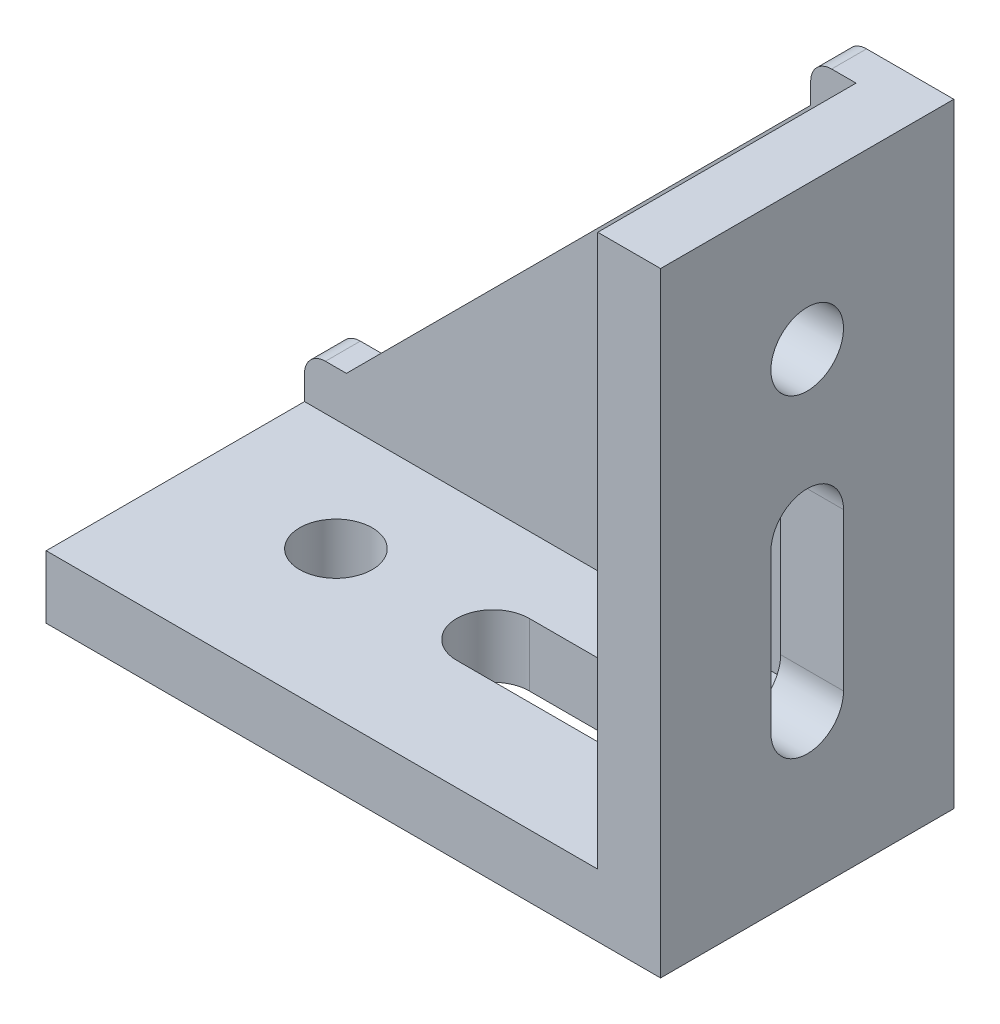
from build123d import *

# Parameters (mm, degrees)
EXTRUDE_1_DEPTH     = 21
EXTRUDE_2_DEPTH     = 5
SKETCH_5_R          = 5.2
CUT_EXTRUDE_1_DEPTH = 121.108284477


with BuildPart() as part:
    # 草图1 → 凸台-拉伸1 (new, symmetric)
    with BuildSketch(Plane.XY):
        Polygon((-88, 0), (0, 0), (0, 88), (-9, 88), (-9, 9), (-88, 9), align=None)
    extrude(amount=EXTRUDE_1_DEPTH, both=True)

    # 草图4 → 凸台-拉伸2 (add)
    with BuildSketch(Plane(origin=(0, 0, -21), x_dir=(-1, 0, 0), z_dir=(0, 0, -1))):
        with BuildLine():
            Line((88, 9), (88, 12.5))
            ThreePointArc((88, 12.5), (87.121320344, 14.621320344), (85, 15.5))
            Line((85, 15.5), (82, 15.5))
            Line((82, 15.5), (15.5, 82))
            Line((15.5, 82), (15.5, 85))
            ThreePointArc((15.5, 85), (14.621320344, 87.121320344), (12.5, 88))
            Line((12.5, 88), (9, 88))
            Line((9, 88), (9, 9))
            Line((9, 9), (88, 9))
        make_face()
    extrude(amount=-EXTRUDE_2_DEPTH)

    # 草图5 → 切除-拉伸1 (cut, through all)
    with BuildSketch(Plane(origin=(0, 9, 0), x_dir=(1, 0, 0), z_dir=(0, 1, 0))):
        with Locations(Location((-67.5, 0, 0), (0, 0, 270))):
            Circle(SKETCH_5_R)
        with BuildLine():
            Line((-45, 5.2), (-22.5, 5.2))
            ThreePointArc((-22.5, 5.2), (-17.3, 0), (-22.5, -5.2))
            Line((-22.5, -5.2), (-45, -5.2))
            ThreePointArc((-45, -5.2), (-50.2, 0), (-45, 5.2))
        make_face()
    cut_extrude_1 = extrude(amount=-CUT_EXTRUDE_1_DEPTH, mode=Mode.SUBTRACT)

    # 镜向1: 切除-拉伸1 across plane
    add(cut_extrude_1.mirror(Plane(origin=(0, 0, 0), x_dir=(0, 0, 1), z_dir=(-0.7071067811865477, -0.7071067811865475, 0))), mode=Mode.SUBTRACT)


solid = part.part
